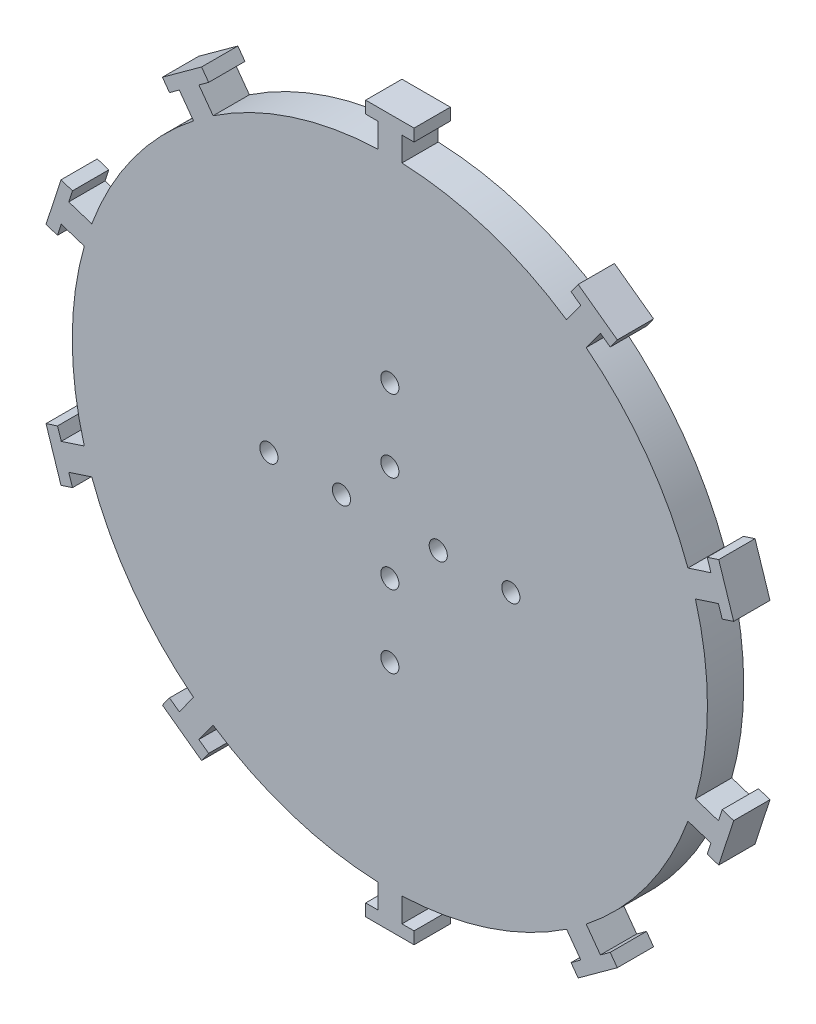
from build123d import *
from build123d.topology import SkipClean

# Parameters (mm, degrees)
SKETCH1_R           = 52.5
BOSS_EXTRUDE1_DEPTH = 2
BOSS_EXTRUDE2_DEPTH = 6
CIRPATTERN1_COUNT   = 10
SKETCH4_R           = 1.5
CUT_EXTRUDE2_DEPTH  = 10
SKETCH7_R           = 1.5
CUT_EXTRUDE3_DEPTH  = 10


with BuildPart() as part:
    # Sketch1 → Boss-Extrude1 (new body)
    with BuildSketch(Plane.XY):
        Circle(SKETCH1_R)
    extrude(amount=BOSS_EXTRUDE1_DEPTH)

    # Sketch6 → Boss-Extrude2 (add)
    with SkipClean():  # the faces are left unmerged after this step: merging them gives an invalid solid
        with BuildSketch(Plane.XY):
            with BuildLine():
                Line((-2, 52.46189093), (-2, 56.46189093))
                Line((-2, 56.46189093), (-4, 56.46189093))
                Line((-4, 56.46189093), (-4, 58.46189093))
                Line((-4, 58.46189093), (4, 58.46189093))
                Line((4, 58.46189093), (4, 56.46189093))
                Line((4, 56.46189093), (2, 56.46189093))
                Line((2, 56.46189093), (2, 52.46189093))
                ThreePointArc((2, 52.46189093), (0, -52.5), (-2, 52.46189093))
            make_face()
        boss_extrude2 = extrude(amount=BOSS_EXTRUDE2_DEPTH)

    # CirPattern1: Boss-Extrude2 ×10 about axis
    cirpattern1_axis = Axis((0, 0, 0), (0, 0, 1))
    for i in range(1, CIRPATTERN1_COUNT):
        add(boss_extrude2.rotate(cirpattern1_axis, i * 360 / CIRPATTERN1_COUNT))

    # Sketch4 → Cut-Extrude2 (cut, symmetric)
    with BuildSketch(Plane.XY.offset(2)):
        with Locations((0, 8)):
            Circle(SKETCH4_R)
        with Locations((8, 0)):
            Circle(SKETCH4_R)
        with Locations((0, -8)):
            Circle(SKETCH4_R)
        with Locations((-8, 0)):
            Circle(SKETCH4_R)
    extrude(amount=CUT_EXTRUDE2_DEPTH, both=True, mode=Mode.SUBTRACT)

    # Sketch7 → Cut-Extrude3 (cut, symmetric)
    with BuildSketch(Plane.XY.offset(6)):
        with Locations((0, 20)):
            Circle(SKETCH7_R)
        with Locations((20, 0)):
            Circle(SKETCH7_R)
        with Locations((0, -20)):
            Circle(SKETCH7_R)
        with Locations((-20, 0)):
            Circle(SKETCH7_R)
    extrude(amount=CUT_EXTRUDE3_DEPTH, both=True, mode=Mode.SUBTRACT)


solid = part.part
